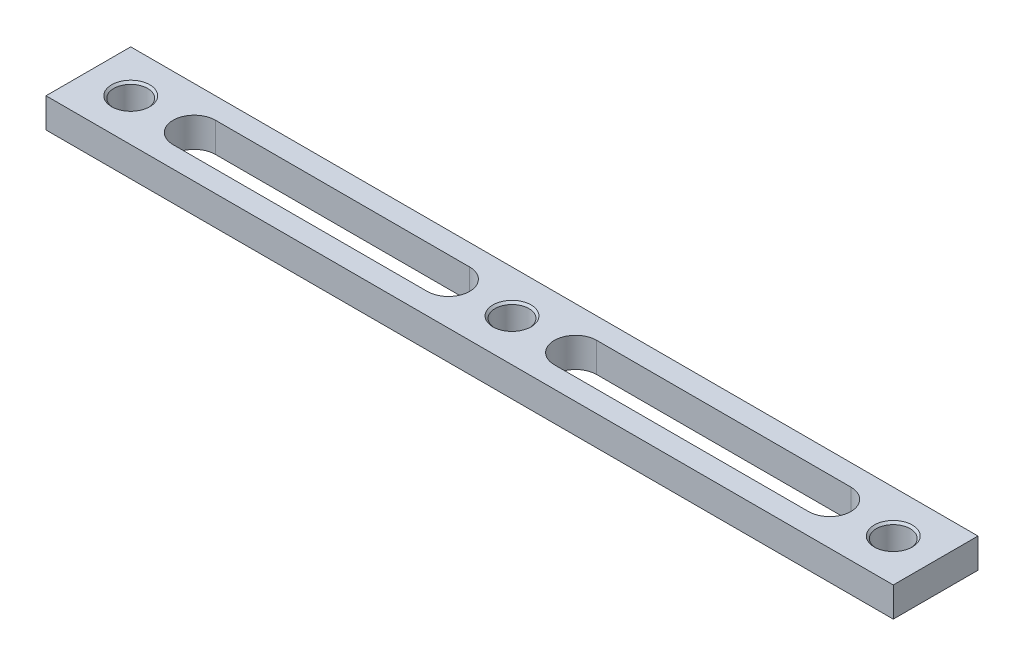
from build123d import *

# Parameters (mm, degrees)
SZKIC1_W                            = 200
SZKIC1_H                            = 20
DODANIE_WYCI_GNI_CIE1_DEPTH         = 7
OTWORY_USTALAJ_CE_8_0MM1_AT_2_COUNT = 2
OTWORY_USTALAJ_CE_8_0MM1_AT_2_PITCH = 90
OTWORY_USTALAJ_CE_8_0MM1_AT_3_COUNT = 2
OTWORY_USTALAJ_CE_8_0MM1_AT_3_PITCH = 180


with BuildPart() as part:
    # Szkic1 → Dodanie-wyciągnięcie1 (new body)
    with BuildSketch(Plane(origin=(0, 0, 0), x_dir=(1, 0, 0), z_dir=(0, 1, 0))):
        Rectangle(SZKIC1_W, SZKIC1_H)
        with BuildLine():
            Line((-75, 5), (-15, 5))
            ThreePointArc((-15, 5), (-10, 0), (-15, -5))
            Line((-15, -5), (-75, -5))
            ThreePointArc((-75, -5), (-80, 0), (-75, 5))
        make_face(mode=Mode.SUBTRACT)
        with BuildLine():
            Line((75, 5), (15, 5))
            ThreePointArc((15, 5), (10, 0), (15, -5))
            Line((15, -5), (75, -5))
            ThreePointArc((75, -5), (80, 0), (75, 5))
        make_face(mode=Mode.SUBTRACT)
    extrude(amount=DODANIE_WYCI_GNI_CIE1_DEPTH)

    # Szkic4 → Otwory ustalające Ø8.0mm1 (revolve, cut)
    with BuildSketch(Plane(origin=(-90, 7, 0), x_dir=(0, 0, 1), z_dir=(1, 0, 0))):
        Polygon((0, 0), (0, 7), (4.5, 7), (4, 6.5), (4, 0.5), (4.5, 0), align=None)
    otwory_ustalaj_ce_8_0mm1 = revolve(axis=Axis((-90, 13.35, 0), (0, -1, 0)), mode=Mode.SUBTRACT)

    # Otwory ustalające Ø8.0mm1 at 2: Otwory ustalające Ø8.0mm1 ×2
    with Locations(*[(i * OTWORY_USTALAJ_CE_8_0MM1_AT_2_PITCH, 0, 0) for i in range(1, OTWORY_USTALAJ_CE_8_0MM1_AT_2_COUNT)]):
        add(otwory_ustalaj_ce_8_0mm1, mode=Mode.SUBTRACT)

    # Otwory ustalające Ø8.0mm1 at 3: Otwory ustalające Ø8.0mm1 ×2
    with Locations(*[(i * OTWORY_USTALAJ_CE_8_0MM1_AT_3_PITCH, 0, 0) for i in range(1, OTWORY_USTALAJ_CE_8_0MM1_AT_3_COUNT)]):
        add(otwory_ustalaj_ce_8_0mm1, mode=Mode.SUBTRACT)


solid = part.part
